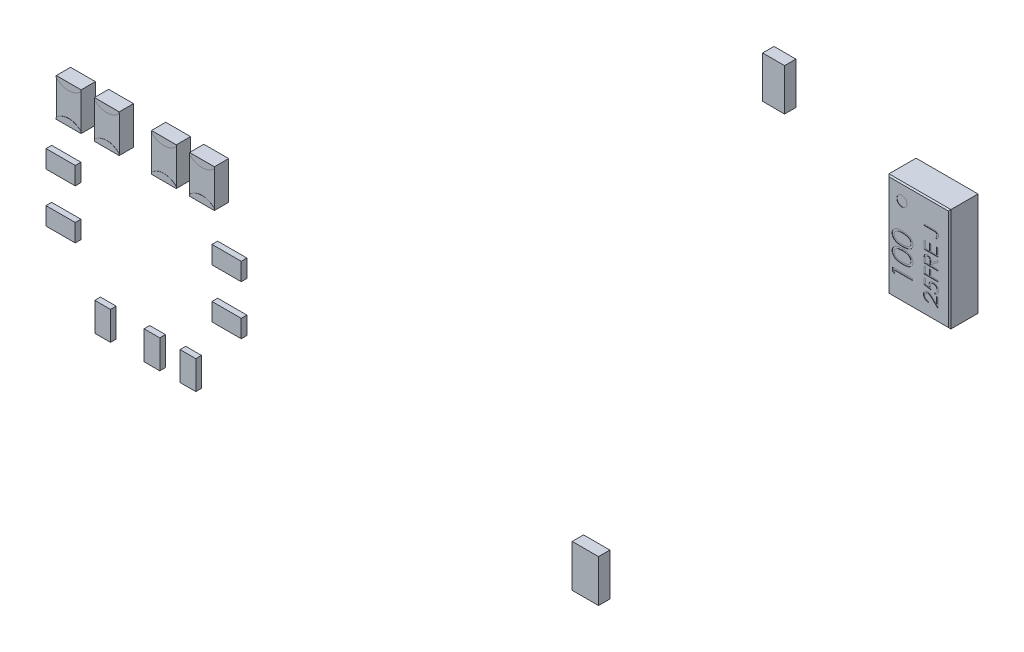
from build123d import *

# Parameters (mm, degrees)
SZKIC1_W                      = 4.373721056
SZKIC1_H                      = 7.300749762
DODANIE_WYCI_GNI_CIE1_DEPTH   = 2
SFAZOWANIE1_SIZE              = 0.09
SZKIC2_R                      = 0.357953931
WYTNIJ_WYCI_GNI_CIE1_DEPTH    = 0.02
SZKIC3_W                      = 2.452582434
SZKIC3_H                      = 1.034404964
DODANIE_WYCI_GNI_CIE2_DEPTH   = 0.1
SZKIC4_W                      = 1.85738294
SZKIC4_H                      = 2.99399041
DODANIE_WYCI_GNI_CIE3_DEPTH   = 0.8
SZKIC4_W_2                    = 1.547624374
SZKIC4_H_2                    = 2.960672714
DODANIE_WYCI_GNI_CIE3_2_DEPTH = 0.8
SZKIC5_W                      = 1.752306705
SZKIC5_H                      = 2.673622601
DODANIE_WYCI_GNI_CIE4_DEPTH   = 1
DODANIE_WYCI_GNI_CIE4_2_DEPTH = 1
DODANIE_WYCI_GNI_CIE4_3_DEPTH = 1
DODANIE_WYCI_GNI_CIE4_4_DEPTH = 1
DODANIE_WYCI_GNI_CIE5_DEPTH   = 0.01
DODANIE_WYCI_GNI_CIE5_2_DEPTH = 0.01
DODANIE_WYCI_GNI_CIE5_3_DEPTH = 0.01
DODANIE_WYCI_GNI_CIE5_4_DEPTH = 0.01
DODANIE_WYCI_GNI_CIE5_5_DEPTH = 0.01
DODANIE_WYCI_GNI_CIE5_6_DEPTH = 0.01
DODANIE_WYCI_GNI_CIE5_7_DEPTH = 0.01
DODANIE_WYCI_GNI_CIE5_8_DEPTH = 0.01
SZKIC7_W                      = 2.063385055
SZKIC7_H                      = 1.252139649
DODANIE_WYCI_GNI_CIE6_DEPTH   = 0.4
SZKIC7_W_2                    = 1.109303583
SZKIC7_H_2                    = 2.016915605
DODANIE_WYCI_GNI_CIE6_2_DEPTH = 0.4
SZKIC7_W_3                    = 2.063385056
DODANIE_WYCI_GNI_CIE6_3_DEPTH = 0.4
DODANIE_WYCI_GNI_CIE6_4_DEPTH = 0.4
DODANIE_WYCI_GNI_CIE6_5_DEPTH = 0.4
DODANIE_WYCI_GNI_CIE6_6_DEPTH = 0.4
DODANIE_WYCI_GNI_CIE6_7_DEPTH = 0.4


with BuildPart() as part:
    # Szkic1 → Dodanie-wyciągnięcie1 (new body)
    with BuildSketch(Plane.XY):
        with Locations((30.503224467, 15.085500347)):
            Rectangle(SZKIC1_W, SZKIC1_H)
    extrude(amount=DODANIE_WYCI_GNI_CIE1_DEPTH)

    # Sfazowanie1
    sfazowanie1_edges = [part.edges().sort_by_distance(p)[0] for p in [
        (30.503224467, 18.735875228, 2),
        (28.316363939, 15.085500347, 2),
        (30.503224467, 11.435125466, 2),
        (32.690084995, 15.085500347, 2),
    ]]
    chamfer(sfazowanie1_edges, length=SFAZOWANIE1_SIZE)

    # Szkic2 → Wytnij-wyciągnięcie1 (cut)
    # profile 1 of 10: a face of its own
    with BuildSketch(Plane.XY.offset(2)):
        with Locations((29.31812513, 17.607576916)):
            Circle(SZKIC2_R)
    # profile 2 of 10: a face of its own
    with BuildSketch(Plane.XY.offset(2)):
        Polygon((28.664949594, 12.997179442), (28.664949594, 13.256033609), (30.064949594, 13.256033609), (30.064949594, 13.130392583), (28.808539337, 13.130392583), (28.808539337, 12.915007968), align=None)
    # profile 3 of 10: a face of its own
    with BuildSketch(Plane.XY.offset(2)):
        with BuildLine():
            add(Edge.make_bspline(
                [(29.365510491, 13.776546429), (29.343071536, 13.776677637), (29.299483542, 13.776932509), (29.235969686, 13.779767877), (29.17638557, 13.784478014), (29.120728344, 13.790932963), (29.068983637, 13.798788154), (29.021289737, 13.809274352), (28.977425884, 13.821199463), (28.937249101, 13.835020476), (28.900217893, 13.850615473), (28.865648259, 13.867589593), (28.833589905, 13.886614038), (28.803540441, 13.906610068), (28.775958808, 13.928356125), (28.750527213, 13.951385933), (28.727460125, 13.97616009), (28.706741747, 14.002438311), (28.688574754, 14.030042496), (28.672474095, 14.058218325), (28.659212068, 14.087469238), (28.648363364, 14.117410163), (28.639507318, 14.148104204), (28.633424121, 14.179543526), (28.629603389, 14.211801006), (28.629237645, 14.233573452), (28.629052158, 14.24461534)],
                knots=[0, 0, 0, 0, 1.646148282, 3.197666765, 4.66315463, 6.030252048, 7.307778049, 8.501004361, 9.610818041, 10.641065266, 11.615491391, 12.557119604, 13.464013759, 14.348536654, 15.203310953, 16.038349431, 16.863300206, 17.683791446, 18.490318933, 19.285717724, 20.06220424, 20.843281102, 21.620494212, 22.403315558, 23.190242141, 24, 24, 24, 24], degree=3))
            add(Edge.make_bspline(
                [(28.629052158, 14.24461534), (28.629206658, 14.255754931), (28.629514058, 14.277918796), (28.633840906, 14.310568856), (28.639425693, 14.342650207), (28.648382772, 14.373676112), (28.659101079, 14.404233211), (28.673243715, 14.433561612), (28.688624929, 14.46269676), (28.707388717, 14.490315086), (28.72812579, 14.517241775), (28.75166767, 14.542482734), (28.777362832, 14.566683191), (28.805784354, 14.588929102), (28.836496448, 14.610173898), (28.869756572, 14.629611104), (28.905491017, 14.647644978), (28.943534121, 14.66461451), (28.984902077, 14.679453918), (29.02933686, 14.692647337), (29.07724085, 14.703461577), (29.12834719, 14.712404763), (29.182909062, 14.719346378), (29.240815915, 14.724398368), (29.302103978, 14.727067905), (29.344007131, 14.727570543), (29.365510491, 14.727828481)],
                knots=[0, 0, 0, 0, 0.810910589, 1.61342667, 2.396193133, 3.181089899, 3.963115317, 4.752255436, 5.550715454, 6.36105385, 7.181178335, 8.024612154, 8.872680183, 9.750181803, 10.651284446, 11.591556747, 12.554036451, 13.566402641, 14.62422919, 15.753422176, 16.94128843, 18.199818041, 19.531985927, 20.947085226, 22.433341622, 24, 24, 24, 24], degree=3))
            add(Edge.make_bspline(
                [(29.365510491, 14.727828481), (29.386919867, 14.727564868), (29.42872854, 14.727050081), (29.489743711, 14.724455622), (29.547338434, 14.719222981), (29.601574114, 14.712773093), (29.652475896, 14.70372995), (29.700010612, 14.69283371), (29.744346558, 14.680419065), (29.785166072, 14.665351912), (29.82314316, 14.64877736), (29.858614851, 14.630762837), (29.891866192, 14.611435319), (29.922659295, 14.590509146), (29.950966737, 14.567897312), (29.976750029, 14.543713818), (30.000441645, 14.518252475), (30.021407179, 14.491168809), (30.040313825, 14.463293235), (30.056253215, 14.434155126), (30.070063761, 14.404500205), (30.081355157, 14.374032397), (30.090111766, 14.34279874), (30.096131458, 14.3106954), (30.100362839, 14.277914189), (30.100685074, 14.25575339), (30.10084703, 14.24461534)],
                knots=[0, 0, 0, 0, 1.561645053, 3.049612875, 4.452756685, 5.778837748, 7.032101753, 8.221335837, 9.334924186, 10.387562255, 11.392109817, 12.355697819, 13.287721948, 14.19548756, 15.068665045, 15.927346723, 16.771751757, 17.602390507, 18.423119567, 19.225778204, 20.022010933, 20.807278863, 21.593079439, 22.384715467, 23.188155646, 24, 24, 24, 24], degree=3))
            add(Edge.make_bspline(
                [(30.10084703, 14.24461534), (30.100660487, 14.233573694), (30.100292663, 14.211801724), (30.09648717, 14.179540754), (30.090368969, 14.148227777), (30.081802328, 14.117708274), (30.07131639, 14.087825673), (30.057654929, 14.05898714), (30.041921255, 14.030872135), (30.024003262, 14.003555253), (30.003473919, 13.97755138), (29.980770755, 13.95270816), (29.955311583, 13.929672673), (29.927497232, 13.908115174), (29.89740306, 13.887907751), (29.865008872, 13.869047702), (29.830259353, 13.851717622), (29.792935484, 13.835856186), (29.752473545, 13.821793254), (29.708497878, 13.809419246), (29.660561823, 13.799536507), (29.608908759, 13.791159357), (29.553433732, 13.784446637), (29.494116672, 13.779769833), (29.431070217, 13.776934661), (29.387762517, 13.776678202), (29.365510491, 13.776546429)],
                knots=[0, 0, 0, 0, 0.810927267, 1.598990287, 2.382942141, 3.152806972, 3.926217614, 4.706701772, 5.493896336, 6.292070767, 7.104102563, 7.925577746, 8.761822141, 9.623241997, 10.509042271, 11.423174113, 12.375371989, 13.360203808, 14.400680605, 15.520553799, 16.714061498, 17.994519714, 19.364400916, 20.818312473, 22.365209998, 24, 24, 24, 24], degree=3))
        make_face()
        with BuildLine():
            add(Edge.make_bspline(
                [(29.364949594, 13.902187455), (29.383648998, 13.902236282), (29.419940871, 13.902331044), (29.472586001, 13.904735007), (29.521770614, 13.908081079), (29.567475515, 13.912290629), (29.609540965, 13.918595029), (29.648141847, 13.925747757), (29.683206711, 13.934327017), (29.715041982, 13.944527874), (29.744098461, 13.956147643), (29.771150605, 13.968812114), (29.796519034, 13.982537915), (29.820142198, 13.997606397), (29.841731332, 14.014315472), (29.861833671, 14.031890508), (29.879750072, 14.051123248), (29.901241577, 14.077723562), (29.92344887, 14.11284271), (29.942787415, 14.157090724), (29.95494037, 14.202558146), (29.956485876, 14.233418641), (29.957257286, 14.24882207)],
                knots=[0, 0, 0, 0, 1.459098681, 2.831824031, 4.11146945, 5.306290378, 6.412266529, 7.42953815, 8.369053297, 9.227277979, 10.03601793, 10.809473603, 11.557037441, 12.285528272, 12.993193355, 13.685654407, 14.36688038, 15.041354379, 16.352855396, 17.594313975, 18.799247529, 20, 20, 20, 20], degree=3))
            add(Edge.make_bspline(
                [(29.957257286, 14.24882207), (29.956581824, 14.264314664), (29.955233297, 14.295244897), (29.943463884, 14.340670553), (29.924330555, 14.384405148), (29.902471181, 14.418920026), (29.881520504, 14.445105466), (29.863678632, 14.463873824), (29.843695176, 14.481098209), (29.822135766, 14.497435159), (29.798586687, 14.512418756), (29.773161681, 14.526044021), (29.745790003, 14.538477357), (29.726682108, 14.545560976), (29.716912735, 14.549182647)],
                knots=[0, 0, 0, 0, 1.353621445, 2.702441307, 4.075953605, 5.516772412, 6.261413105, 7.007624062, 7.778524365, 8.566925914, 9.372323995, 10.217594641, 11.088702136, 12, 12, 12, 12], degree=3))
            add(Edge.make_bspline(
                [(29.716912735, 14.549182647), (29.704420839, 14.553403354), (29.679056933, 14.5619732), (29.639711472, 14.57301791), (29.598430367, 14.581716069), (29.55546032, 14.589541416), (29.51048444, 14.594882638), (29.463641886, 14.599181763), (29.414897341, 14.601714038), (29.381779345, 14.602027939), (29.364949594, 14.602187455)],
                knots=[0, 0, 0, 0, 0.884706709, 1.796334032, 2.740027952, 3.714592787, 4.726048262, 5.777819803, 6.87074269, 8, 8, 8, 8], degree=3))
            add(Edge.make_bspline(
                [(29.364949594, 14.602187455), (29.348122565, 14.601967379), (29.315205299, 14.601536864), (29.266998027, 14.599891269), (29.221210922, 14.595641839), (29.177646733, 14.590922192), (29.136546611, 14.583963304), (29.097566492, 14.576460178), (29.061189271, 14.566379704), (29.026845478, 14.555611756), (28.99492508, 14.54328773), (28.965280036, 14.529720979), (28.937764498, 14.515233877), (28.912463481, 14.499491383), (28.889230228, 14.482712776), (28.868599334, 14.464296467), (28.84956722, 14.44541203), (28.828230815, 14.418554379), (28.806304137, 14.383678902), (28.786674781, 14.339982679), (28.775057599, 14.294758972), (28.773446553, 14.26412333), (28.772641901, 14.24882207)],
                knots=[0, 0, 0, 0, 1.313483664, 2.569454835, 3.763100662, 4.901599063, 5.988328865, 7.015709358, 7.99797933, 8.932480776, 9.824041341, 10.666387587, 11.475829342, 12.24921787, 12.990555181, 13.709176526, 14.405678811, 15.080244297, 16.38186033, 17.610124501, 18.806354173, 20, 20, 20, 20], degree=3))
            add(Edge.make_bspline(
                [(28.772641901, 14.24882207), (28.773448555, 14.233335481), (28.775063333, 14.202334091), (28.786621056, 14.156627436), (28.806246705, 14.112636019), (28.828188571, 14.077645536), (28.849485414, 14.05111416), (28.86761148, 14.032286874), (28.887233683, 14.014468097), (28.909014337, 13.998191701), (28.932554265, 13.983212572), (28.957594636, 13.968956317), (28.984697327, 13.956461203), (29.013731021, 13.94480413), (29.045568044, 13.934586258), (29.080759784, 13.926105025), (29.119452848, 13.918383866), (29.161825653, 13.912823373), (29.207540308, 13.907926989), (29.256850702, 13.904771741), (29.309676611, 13.902320032), (29.346156252, 13.902232532), (29.364949594, 13.902187455)],
                knots=[0, 0, 0, 0, 1.207546505, 2.417292871, 3.651582144, 4.952510111, 5.626719005, 6.30238548, 6.989136872, 7.692112372, 8.420316868, 9.164734959, 9.937886623, 10.746308695, 11.604196049, 12.543341915, 13.568754172, 14.680483261, 15.875568977, 17.154711427, 18.534182925, 20, 20, 20, 20], degree=3))
        make_face(mode=Mode.SUBTRACT)
    # profile 4 of 10: a face of its own
    with BuildSketch(Plane.XY.offset(2)):
        with BuildLine():
            add(Edge.make_bspline(
                [(29.365510491, 14.853469506), (29.343071536, 14.853600714), (29.299483542, 14.853855586), (29.235969686, 14.856690954), (29.17638557, 14.861401091), (29.120728344, 14.86785604), (29.068983637, 14.875711231), (29.021289737, 14.886197429), (28.977425884, 14.89812254), (28.937249101, 14.911943552), (28.900217893, 14.92753855), (28.865648259, 14.94451267), (28.833589905, 14.963537115), (28.803540441, 14.983533145), (28.775958808, 15.005279202), (28.750527213, 15.02830901), (28.727460125, 15.053083167), (28.706741747, 15.079361388), (28.688574754, 15.106965573), (28.672474095, 15.135141402), (28.659212068, 15.164392315), (28.648363364, 15.19433324), (28.639507318, 15.225027281), (28.633424121, 15.256466603), (28.629603389, 15.288724083), (28.629237645, 15.310496529), (28.629052158, 15.321538417)],
                knots=[0, 0, 0, 0, 1.646148282, 3.197666765, 4.66315463, 6.030252048, 7.307778049, 8.501004361, 9.610818041, 10.641065266, 11.615491391, 12.557119604, 13.464013759, 14.348536654, 15.203310953, 16.038349431, 16.863300206, 17.683791446, 18.490318933, 19.285717724, 20.06220424, 20.843281102, 21.620494212, 22.403315558, 23.190242141, 24, 24, 24, 24], degree=3))
            add(Edge.make_bspline(
                [(28.629052158, 15.321538417), (28.629206658, 15.332678008), (28.629514058, 15.354841873), (28.633840906, 15.387491933), (28.639425693, 15.419573284), (28.648382772, 15.450599189), (28.659101079, 15.481156288), (28.673243715, 15.510484689), (28.688624929, 15.539619837), (28.707388717, 15.567238163), (28.72812579, 15.594164852), (28.75166767, 15.619405811), (28.777362832, 15.643606268), (28.805784354, 15.665852179), (28.836496448, 15.687096975), (28.869756572, 15.706534181), (28.905491017, 15.724568055), (28.943534121, 15.741537587), (28.984902077, 15.756376995), (29.02933686, 15.769570414), (29.07724085, 15.780384654), (29.12834719, 15.78932784), (29.182909062, 15.796269455), (29.240815915, 15.801321445), (29.302103978, 15.803990982), (29.344007131, 15.80449362), (29.365510491, 15.804751558)],
                knots=[0, 0, 0, 0, 0.810910589, 1.61342667, 2.396193133, 3.181089899, 3.963115317, 4.752255436, 5.550715454, 6.36105385, 7.181178335, 8.024612154, 8.872680183, 9.750181803, 10.651284446, 11.591556747, 12.554036451, 13.566402641, 14.62422919, 15.753422176, 16.94128843, 18.199818041, 19.531985927, 20.947085226, 22.433341622, 24, 24, 24, 24], degree=3))
            add(Edge.make_bspline(
                [(29.365510491, 15.804751558), (29.386919867, 15.804487945), (29.42872854, 15.803973157), (29.489743711, 15.801378699), (29.547338434, 15.796146058), (29.601574114, 15.78969617), (29.652475896, 15.780653026), (29.700010612, 15.769756787), (29.744346558, 15.757342142), (29.785166072, 15.742274989), (29.82314316, 15.725700437), (29.858614851, 15.707685914), (29.891866192, 15.688358396), (29.922659295, 15.667432223), (29.950966737, 15.644820389), (29.976750029, 15.620636895), (30.000441645, 15.595175552), (30.021407179, 15.568091886), (30.040313825, 15.540216312), (30.056253215, 15.511078203), (30.070063761, 15.481423282), (30.081355157, 15.450955474), (30.090111766, 15.419721817), (30.096131458, 15.387618477), (30.100362839, 15.354837266), (30.100685074, 15.332676466), (30.10084703, 15.321538417)],
                knots=[0, 0, 0, 0, 1.561645053, 3.049612875, 4.452756685, 5.778837748, 7.032101753, 8.221335837, 9.334924186, 10.387562255, 11.392109817, 12.355697819, 13.287721948, 14.19548756, 15.068665045, 15.927346723, 16.771751757, 17.602390507, 18.423119567, 19.225778204, 20.022010933, 20.807278863, 21.593079439, 22.384715467, 23.188155646, 24, 24, 24, 24], degree=3))
            add(Edge.make_bspline(
                [(30.10084703, 15.321538417), (30.100660487, 15.310496771), (30.100292663, 15.288724801), (30.09648717, 15.256463831), (30.090368969, 15.225150854), (30.081802328, 15.194631351), (30.07131639, 15.16474875), (30.057654929, 15.135910217), (30.041921255, 15.107795212), (30.024003262, 15.08047833), (30.003473919, 15.054474457), (29.980770755, 15.029631237), (29.955311583, 15.00659575), (29.927497232, 14.985038251), (29.89740306, 14.964830827), (29.865008872, 14.945970779), (29.830259353, 14.928640699), (29.792935484, 14.912779263), (29.752473545, 14.898716331), (29.708497878, 14.886342323), (29.660561823, 14.876459584), (29.608908759, 14.868082434), (29.553433732, 14.861369714), (29.494116672, 14.85669291), (29.431070217, 14.853857738), (29.387762517, 14.853601278), (29.365510491, 14.853469506)],
                knots=[0, 0, 0, 0, 0.810927267, 1.598990287, 2.382942141, 3.152806972, 3.926217614, 4.706701772, 5.493896336, 6.292070767, 7.104102563, 7.925577746, 8.761822141, 9.623241997, 10.509042271, 11.423174113, 12.375371989, 13.360203808, 14.400680605, 15.520553799, 16.714061498, 17.994519714, 19.364400916, 20.818312473, 22.365209998, 24, 24, 24, 24], degree=3))
        make_face()
        with BuildLine():
            add(Edge.make_bspline(
                [(29.364949594, 14.979110532), (29.383648998, 14.979159358), (29.419940871, 14.979254121), (29.472586001, 14.981658084), (29.521770614, 14.985004155), (29.567475515, 14.989213706), (29.609540965, 14.995518106), (29.648141847, 15.002670833), (29.683206711, 15.011250094), (29.715041982, 15.021450951), (29.744098461, 15.03307072), (29.771150605, 15.045735191), (29.796519034, 15.059460992), (29.820142198, 15.074529473), (29.841731332, 15.091238549), (29.861833671, 15.108813584), (29.879750072, 15.128046325), (29.901241577, 15.154646639), (29.92344887, 15.189765787), (29.942787415, 15.234013801), (29.95494037, 15.279481223), (29.956485876, 15.310341718), (29.957257286, 15.325745147)],
                knots=[0, 0, 0, 0, 1.459098681, 2.831824031, 4.11146945, 5.306290378, 6.412266529, 7.42953815, 8.369053297, 9.227277979, 10.03601793, 10.809473603, 11.557037441, 12.285528272, 12.993193355, 13.685654407, 14.36688038, 15.041354379, 16.352855396, 17.594313975, 18.799247529, 20, 20, 20, 20], degree=3))
            add(Edge.make_bspline(
                [(29.957257286, 15.325745147), (29.956581824, 15.341237741), (29.955233297, 15.372167974), (29.943463884, 15.41759363), (29.924330555, 15.461328225), (29.902471181, 15.495843103), (29.881520504, 15.522028543), (29.863678632, 15.540796901), (29.843695176, 15.558021286), (29.822135766, 15.574358236), (29.798586687, 15.589341833), (29.773161681, 15.602967098), (29.745790003, 15.615400434), (29.726682108, 15.622484053), (29.716912735, 15.626105724)],
                knots=[0, 0, 0, 0, 1.353621445, 2.702441307, 4.075953605, 5.516772412, 6.261413105, 7.007624062, 7.778524365, 8.566925914, 9.372323995, 10.217594641, 11.088702136, 12, 12, 12, 12], degree=3))
            add(Edge.make_bspline(
                [(29.716912735, 15.626105724), (29.704420839, 15.630326431), (29.679056933, 15.638896277), (29.639711472, 15.649940987), (29.598430367, 15.658639146), (29.55546032, 15.666464493), (29.51048444, 15.671805715), (29.463641886, 15.67610484), (29.414897341, 15.678637115), (29.381779345, 15.678951015), (29.364949594, 15.679110532)],
                knots=[0, 0, 0, 0, 0.884706709, 1.796334032, 2.740027952, 3.714592787, 4.726048262, 5.777819803, 6.87074269, 8, 8, 8, 8], degree=3))
            add(Edge.make_bspline(
                [(29.364949594, 15.679110532), (29.348122565, 15.678890456), (29.315205299, 15.678459941), (29.266998027, 15.676814346), (29.221210922, 15.672564916), (29.177646733, 15.667845269), (29.136546611, 15.660886381), (29.097566492, 15.653383255), (29.061189271, 15.643302781), (29.026845478, 15.632534833), (28.99492508, 15.620210807), (28.965280036, 15.606644056), (28.937764498, 15.592156954), (28.912463481, 15.57641446), (28.889230228, 15.559635852), (28.868599334, 15.541219544), (28.84956722, 15.522335106), (28.828230815, 15.495477456), (28.806304137, 15.460601979), (28.786674781, 15.416905756), (28.775057599, 15.371682049), (28.773446553, 15.341046407), (28.772641901, 15.325745147)],
                knots=[0, 0, 0, 0, 1.313483664, 2.569454835, 3.763100662, 4.901599063, 5.988328865, 7.015709358, 7.99797933, 8.932480776, 9.824041341, 10.666387587, 11.475829342, 12.24921787, 12.990555181, 13.709176526, 14.405678811, 15.080244297, 16.38186033, 17.610124501, 18.806354173, 20, 20, 20, 20], degree=3))
            add(Edge.make_bspline(
                [(28.772641901, 15.325745147), (28.773448555, 15.310258558), (28.775063333, 15.279257168), (28.786621056, 15.233550513), (28.806246705, 15.189559096), (28.828188571, 15.154568613), (28.849485414, 15.128037237), (28.86761148, 15.109209951), (28.887233683, 15.091391174), (28.909014337, 15.075114778), (28.932554265, 15.060135648), (28.957594636, 15.045879394), (28.984697327, 15.03338428), (29.013731021, 15.021727207), (29.045568044, 15.011509335), (29.080759784, 15.003028102), (29.119452848, 14.995306943), (29.161825653, 14.98974645), (29.207540308, 14.984850066), (29.256850702, 14.981694818), (29.309676611, 14.979243108), (29.346156252, 14.979155609), (29.364949594, 14.979110532)],
                knots=[0, 0, 0, 0, 1.207546505, 2.417292871, 3.651582144, 4.952510111, 5.626719005, 6.30238548, 6.989136872, 7.692112372, 8.420316868, 9.164734959, 9.937886623, 10.746308695, 11.604196049, 12.543341915, 13.568754172, 14.680483261, 15.875568977, 17.154711427, 18.534182925, 20, 20, 20, 20], degree=3))
        make_face(mode=Mode.SUBTRACT)
    # profile 5 of 10: a face of its own
    with BuildSketch(Plane.XY.offset(2)):
        with BuildLine():
            Line((31.179149727, 12.445550109), (31.179149727, 12.355806519))
            add(Edge.make_bspline(
                [(31.179149727, 12.355806519), (31.167243759, 12.35639142), (31.143860754, 12.35754015), (31.10976821, 12.362919661), (31.077181124, 12.370617055), (31.046361149, 12.381500327), (31.017035775, 12.395016407), (30.989321485, 12.411224986), (30.963324003, 12.430423229), (30.939284333, 12.452196581), (30.917230742, 12.475844764), (30.898186387, 12.501360747), (30.882095623, 12.528173612), (30.86864384, 12.556202011), (30.858546741, 12.585762172), (30.851054844, 12.616585846), (30.846547317, 12.648808456), (30.846062807, 12.670762748), (30.845816393, 12.681928314)],
                knots=[0, 0, 0, 0, 1.10065271, 2.161652631, 3.183658789, 4.190468796, 5.17591951, 6.163126047, 7.15150782, 8.156236427, 9.156009102, 10.134482811, 11.092018607, 12.041330605, 13.001268258, 13.972401359, 14.968799086, 16, 16, 16, 16], degree=3))
            add(Edge.make_bspline(
                [(30.845816393, 12.681928314), (30.846071012, 12.69289425), (30.846571329, 12.714441922), (30.850932521, 12.745877295), (30.857615659, 12.775874181), (30.867519017, 12.804092624), (30.879945565, 12.830822225), (30.895399605, 12.855732027), (30.913149905, 12.879424376), (30.934087254, 12.900736491), (30.956427458, 12.920314241), (30.980286608, 12.937189077), (31.004957704, 12.951721819), (31.030633463, 12.963616414), (31.057397498, 12.972633046), (31.084993212, 12.979313506), (31.113739079, 12.983132418), (31.133198655, 12.983715304), (31.143092034, 12.984011648)],
                knots=[0, 0, 0, 0, 1.111674182, 2.184400057, 3.212814286, 4.223731311, 5.211378316, 6.196328225, 7.191884489, 8.207283132, 9.220262353, 10.201199469, 11.166417575, 12.120932471, 13.06540007, 14.026332106, 14.996573967, 16, 16, 16, 16], degree=3))
            add(Edge.make_bspline(
                [(31.143092034, 12.984011648), (31.157019981, 12.983527851), (31.184631459, 12.982568747), (31.225207222, 12.97436475), (31.264519293, 12.961551037), (31.2961596, 12.946124588), (31.32165247, 12.930557973), (31.342652403, 12.916544222), (31.365257735, 12.900045511), (31.389559961, 12.881202795), (31.415240822, 12.859691578), (31.442824277, 12.836070717), (31.471800288, 12.809730196), (31.491604188, 12.791259159), (31.501866073, 12.78168793)],
                knots=[0, 0, 0, 0, 1.184416499, 2.348048165, 3.509039915, 4.696071444, 5.333504901, 6.05069495, 6.844171097, 7.714965912, 8.667477798, 9.695072654, 10.805644396, 12, 12, 12, 12], degree=3))
            Line((31.501866073, 12.78168793), (31.768893316, 12.531487609))
            Line((31.768893316, 12.531487609), (31.768893316, 12.99683216))
            Line((31.768893316, 12.99683216), (31.871457419, 12.99683216))
            Line((31.871457419, 12.99683216), (31.871457419, 12.317344981))
            Line((31.871457419, 12.317344981), (31.457595239, 12.705165494))
            add(Edge.make_bspline(
                [(31.457595239, 12.705165494), (31.44773858, 12.714607747), (31.428805956, 12.732744383), (31.40116511, 12.758396548), (31.375522384, 12.781436259), (31.351926227, 12.802012657), (31.330031494, 12.819679373), (31.310547293, 12.835357153), (31.29261745, 12.847918751), (31.271834417, 12.861551721), (31.246459469, 12.874755716), (31.215449844, 12.886102103), (31.183527772, 12.893020631), (31.161955761, 12.893850584), (31.151104855, 12.894268058)],
                knots=[0, 0, 0, 0, 1.329631726, 2.553950428, 3.673215718, 4.687767853, 5.603093632, 6.413772471, 7.123043292, 7.734684054, 8.834405432, 9.900288307, 10.943827018, 12, 12, 12, 12], degree=3))
            add(Edge.make_bspline(
                [(31.151104855, 12.894268058), (31.144281598, 12.894086417), (31.130834269, 12.893728438), (31.111118338, 12.890569096), (31.09209982, 12.885794666), (31.073720215, 12.878953164), (31.056164314, 12.869922666), (31.039410748, 12.858930272), (31.023213901, 12.846247397), (31.008027244, 12.831575606), (30.994118329, 12.815458029), (30.981797161, 12.7984311), (30.971500272, 12.780416785), (30.963059273, 12.761491035), (30.956437736, 12.741706616), (30.95184957, 12.72102526), (30.948968861, 12.699504112), (30.948579097, 12.684808828), (30.948380496, 12.677320942)],
                knots=[0, 0, 0, 0, 0.991446411, 1.95395049, 2.89581595, 3.838931463, 4.798493298, 5.75982156, 6.748411868, 7.785213223, 8.824556874, 9.840280684, 10.836137867, 11.835679398, 12.848801643, 13.863922112, 14.911575587, 16, 16, 16, 16], degree=3))
            add(Edge.make_bspline(
                [(30.948380496, 12.677320942), (30.94857673, 12.669498742), (30.9489621, 12.654137231), (30.95188109, 12.631631005), (30.956306281, 12.610012794), (30.963334449, 12.589605159), (30.971638579, 12.569966188), (30.982188082, 12.551515141), (30.994446838, 12.533945674), (31.008661365, 12.51754677), (31.024632415, 12.502569352), (31.042233614, 12.489224689), (31.061338248, 12.477641523), (31.081867907, 12.467521203), (31.104026992, 12.459306245), (31.127731806, 12.453027932), (31.152880841, 12.448060337), (31.170247998, 12.446400749), (31.179149727, 12.445550109)],
                knots=[0, 0, 0, 0, 1.030878251, 2.024474673, 2.987898669, 3.934362936, 4.864849709, 5.795128259, 6.730474222, 7.685293701, 8.650606017, 9.611896181, 10.591709709, 11.591680886, 12.625074257, 13.701333388, 14.821793024, 16, 16, 16, 16], degree=3))
        make_face()
    # profile 6 of 10: a face of its own
    with BuildSketch(Plane.XY.offset(2)):
        with BuildLine():
            Line((30.871457419, 13.714780878), (30.974021521, 13.714780878))
            Line((30.974021521, 13.714780878), (30.974021521, 13.374636648))
            Line((30.974021521, 13.374636648), (31.237042355, 13.32075043))
            add(Edge.make_bspline(
                [(31.237042355, 13.32075043), (31.23411942, 13.331337822), (31.228456696, 13.351849221), (31.222169333, 13.382123467), (31.218379206, 13.410864097), (31.217861689, 13.429514202), (31.217611265, 13.438538891)],
                knots=[0, 0, 0, 0, 1.100273476, 2.13160584, 3.095893838, 4, 4, 4, 4], degree=3))
            add(Edge.make_bspline(
                [(31.217611265, 13.438538891), (31.217844979, 13.449707724), (31.218304519, 13.471668439), (31.222979137, 13.503749669), (31.229749941, 13.534528908), (31.240181645, 13.563551703), (31.252920617, 13.591277224), (31.268965631, 13.617229318), (31.287698145, 13.641772225), (31.309021682, 13.664736316), (31.332733288, 13.685471459), (31.358333438, 13.703489614), (31.385263493, 13.719216121), (31.41415464, 13.731481385), (31.444461982, 13.741491038), (31.476535367, 13.748091427), (31.510090055, 13.752500201), (31.533034485, 13.752991756), (31.544734662, 13.753242417)],
                knots=[0, 0, 0, 0, 1.052805225, 2.070078116, 3.052532748, 4.020689046, 4.973125432, 5.925915817, 6.89216474, 7.881560752, 8.877013184, 9.857446635, 10.830895175, 11.812622661, 12.812548702, 13.836681939, 14.896847428, 16, 16, 16, 16], degree=3))
            add(Edge.make_bspline(
                [(31.544734662, 13.753242417), (31.552883817, 13.753052224), (31.569071998, 13.752674409), (31.593113945, 13.750757322), (31.616643406, 13.747052067), (31.639617244, 13.742137748), (31.662056975, 13.735577375), (31.684088239, 13.727903825), (31.705469794, 13.718366112), (31.726296076, 13.70779249), (31.746328733, 13.696084198), (31.765087446, 13.682918483), (31.783000294, 13.669238547), (31.799535292, 13.654290691), (31.814756577, 13.638244864), (31.828739398, 13.621190347), (31.841734706, 13.603281827), (31.853211159, 13.584237247), (31.863772051, 13.564482313), (31.872435906, 13.543731377), (31.880181775, 13.522456896), (31.886355924, 13.500352645), (31.891193797, 13.477468698), (31.894479683, 13.453767334), (31.896872951, 13.429372857), (31.897022767, 13.412837139), (31.897098444, 13.404484404)],
                knots=[0, 0, 0, 0, 1.056393913, 2.098511576, 3.122979385, 4.141471433, 5.141222888, 6.151259816, 7.162667642, 8.172852865, 9.177685681, 10.166741883, 11.141342384, 12.097242845, 13.052202613, 14.005160326, 14.953864445, 15.917140761, 16.884916217, 17.854238259, 18.828761908, 19.81781811, 20.826036654, 21.857789401, 22.917898972, 24, 24, 24, 24], degree=3))
            add(Edge.make_bspline(
                [(31.897098444, 13.404484404), (31.896900531, 13.394520606), (31.896511161, 13.374918012), (31.892456303, 13.346194228), (31.886610409, 13.31857471), (31.877949399, 13.29217783), (31.866608424, 13.267113679), (31.853133629, 13.243023344), (31.837092093, 13.220205413), (31.818630541, 13.198815887), (31.798345185, 13.179154171), (31.776542401, 13.161324782), (31.753194423, 13.145649457), (31.72837717, 13.132071335), (31.702134662, 13.120504012), (31.674386041, 13.111413039), (31.645271533, 13.104076634), (31.625227703, 13.100972763), (31.615047162, 13.099396263)],
                knots=[0, 0, 0, 0, 1.046872515, 2.059598001, 3.044168548, 4.012104806, 4.973680974, 5.932408326, 6.910122221, 7.900780896, 8.89867654, 9.876692837, 10.858029398, 11.85084981, 12.847361615, 13.868568023, 14.917415949, 16, 16, 16, 16], degree=3))
            Line((31.615047162, 13.099396263), (31.615047162, 13.189139853))
            add(Edge.make_bspline(
                [(31.615047162, 13.189139853), (31.624584285, 13.191346631), (31.642915163, 13.19558818), (31.668653762, 13.204922492), (31.691598099, 13.216224482), (31.711888459, 13.229977036), (31.729896253, 13.245918006), (31.745773685, 13.26444856), (31.760115341, 13.28510544), (31.772090342, 13.308071834), (31.782177665, 13.332348423), (31.789376311, 13.357612165), (31.793733806, 13.383499466), (31.794266492, 13.400928786), (31.794534342, 13.409692737)],
                knots=[0, 0, 0, 0, 1.13623081, 2.183898708, 3.172478118, 4.09966615, 5.022692284, 5.957376522, 6.927682873, 7.937366477, 8.960015386, 9.976409503, 10.982481913, 12, 12, 12, 12], degree=3))
            add(Edge.make_bspline(
                [(31.794534342, 13.409692737), (31.794297872, 13.418251567), (31.79383226, 13.435103972), (31.790306401, 13.45991764), (31.784733535, 13.483804284), (31.77692627, 13.506806306), (31.766597717, 13.528810678), (31.753909683, 13.549786288), (31.739178726, 13.570031953), (31.722341779, 13.589014837), (31.703776916, 13.60639662), (31.683926779, 13.621755751), (31.662750394, 13.634549092), (31.640615246, 13.645330283), (31.617278505, 13.653516935), (31.5928496, 13.659357217), (31.567268177, 13.662786662), (31.549819803, 13.663258428), (31.540928573, 13.663498827)],
                knots=[0, 0, 0, 0, 1.027268864, 2.022700798, 3.002744649, 3.968653148, 4.933396556, 5.915045722, 6.907600446, 7.935526002, 8.956456544, 9.95700807, 10.942805781, 11.92166854, 12.907987664, 13.905483474, 14.932689774, 16, 16, 16, 16], degree=3))
            add(Edge.make_bspline(
                [(31.540928573, 13.663498827), (31.532905981, 13.663316406), (31.517269121, 13.66296085), (31.494311792, 13.65988282), (31.472554997, 13.65474102), (31.451904068, 13.647420141), (31.432425032, 13.63828345), (31.414160815, 13.626812057), (31.396939686, 13.613494425), (31.381204816, 13.597946391), (31.366659394, 13.581033348), (31.354304767, 13.562320884), (31.343798163, 13.542308551), (31.335189857, 13.520959264), (31.328332683, 13.498246725), (31.323593597, 13.474158702), (31.320757799, 13.448689703), (31.320373108, 13.431268091), (31.320175368, 13.42231293)],
                knots=[0, 0, 0, 0, 1.045723156, 2.038222538, 3.013889863, 3.95567481, 4.890389958, 5.81331128, 6.76251276, 7.723027653, 8.692928204, 9.666105983, 10.639751036, 11.635719707, 12.66315958, 13.728667616, 14.832476222, 16, 16, 16, 16], degree=3))
            add(Edge.make_bspline(
                [(31.320175368, 13.42231293), (31.320341251, 13.414561807), (31.320683757, 13.398557706), (31.323205614, 13.374008327), (31.327273984, 13.348210691), (31.332870054, 13.321263693), (31.340193219, 13.293086405), (31.348968791, 13.26373829), (31.35946079, 13.233157643), (31.36738428, 13.212552578), (31.371457419, 13.201960366)],
                knots=[0, 0, 0, 0, 0.817624296, 1.688186739, 2.600797293, 3.572016777, 4.590301741, 5.671205678, 6.80286297, 8, 8, 8, 8], degree=3))
            Line((31.371457419, 13.201960366), (30.871457419, 13.304524468))
            Line((30.871457419, 13.304524468), (30.871457419, 13.714780878))
        make_face()
    # profile 7 of 10: a face of its own
    with BuildSketch(Plane.XY.offset(2)):
        Polygon((30.871457419, 13.945550109), (30.871457419, 14.432729596), (30.974021521, 14.432729596), (30.974021521, 14.035293699), (31.281713829, 14.035293699), (31.281713829, 14.432729596), (31.384277932, 14.432729596), (31.384277932, 14.035293699), (31.871457419, 14.035293699), (31.871457419, 13.945550109), align=None)
    # profile 8 of 10: a face of its own
    with BuildSketch(Plane.XY.offset(2)):
        with BuildLine():
            Line((30.871457419, 14.612216776), (30.871457419, 14.812336968))
            add(Edge.make_bspline(
                [(30.871457419, 14.812336968), (30.871501872, 14.825691576), (30.871587227, 14.851333903), (30.872063159, 14.888069123), (30.873427261, 14.921448294), (30.874601142, 14.951453962), (30.876741696, 14.978085578), (30.878787596, 15.001424804), (30.881465784, 15.021364146), (30.883953048, 15.033434389), (30.885079214, 15.038899468)],
                knots=[0, 0, 0, 0, 1.410062039, 2.707475311, 3.878576406, 4.937260626, 5.877586885, 6.699081471, 7.410979367, 8, 8, 8, 8], degree=3))
            add(Edge.make_bspline(
                [(30.885079214, 15.038899468), (30.886886866, 15.046215641), (30.890463608, 15.060691912), (30.898023423, 15.081534871), (30.906772148, 15.101395802), (30.917046547, 15.120194004), (30.928928583, 15.137828679), (30.94219198, 15.15450649), (30.956809948, 15.1701733), (30.972914263, 15.184624645), (30.9901618, 15.197751539), (31.008505222, 15.209265848), (31.027868683, 15.218995227), (31.048282343, 15.226630292), (31.069520702, 15.233036951), (31.09180053, 15.237341437), (31.115047449, 15.24002271), (31.130864972, 15.240287594), (31.138885303, 15.240421904)],
                knots=[0, 0, 0, 0, 1.02737844, 2.032840108, 3.019645024, 3.985760442, 4.950801802, 5.916702504, 6.889791722, 7.870143693, 8.864820395, 9.842884691, 10.820524757, 11.815201459, 12.812418953, 13.84314332, 14.906358105, 16, 16, 16, 16], degree=3))
            add(Edge.make_bspline(
                [(31.138885303, 15.240421904), (31.152209619, 15.24000219), (31.17820881, 15.23918322), (31.21594049, 15.231547476), (31.251137437, 15.219039899), (31.283755334, 15.201804674), (31.313158375, 15.179856252), (31.33898422, 15.15347774), (31.360595623, 15.122654423), (31.375582139, 15.093960332), (31.385180113, 15.068613418), (31.391933358, 15.047746757), (31.397151063, 15.024984764), (31.401825386, 15.000545525), (31.405354442, 14.974327338), (31.407939183, 14.946393041), (31.409554625, 14.916722712), (31.409795198, 14.896340121), (31.409918957, 14.885854596)],
                knots=[0, 0, 0, 0, 1.260483769, 2.459530307, 3.627416485, 4.787058657, 5.939039949, 7.08810263, 8.267026773, 9.491475466, 10.141966685, 10.831826277, 11.566392101, 12.351337768, 13.187381173, 14.07005841, 15.007169909, 16, 16, 16, 16], degree=3))
            Line((31.409918957, 14.885854596), (31.871457419, 15.253242417))
            Line((31.871457419, 15.253242417), (31.871457419, 15.142264853))
            Line((31.871457419, 15.142264853), (31.409918957, 14.774877032))
            Line((31.409918957, 14.774877032), (31.409918957, 14.701960366))
            Line((31.409918957, 14.701960366), (31.871457419, 14.701960366))
            Line((31.871457419, 14.701960366), (31.871457419, 14.612216776))
            Line((31.871457419, 14.612216776), (30.871457419, 14.612216776))
        make_face()
        with BuildLine():
            Line((30.974021521, 14.701960366), (31.307354855, 14.701960366))
            Line((31.307354855, 14.701960366), (31.308757098, 14.885053314))
            add(Edge.make_bspline(
                [(31.308757098, 14.885053314), (31.308760882, 14.893601898), (31.308768217, 14.910171488), (31.307627108, 14.934143091), (31.306329119, 14.956463174), (31.304343253, 14.977046075), (31.301785486, 14.995901945), (31.298581012, 15.013018229), (31.294863654, 15.028433078), (31.289050432, 15.046353027), (31.280242652, 15.066599993), (31.266562588, 15.088122951), (31.250124985, 15.10700762), (31.230786012, 15.122387781), (31.209860653, 15.135273849), (31.187134595, 15.143945661), (31.163345048, 15.149725056), (31.146999777, 15.150356898), (31.138684983, 15.150678314)],
                knots=[0, 0, 0, 0, 1.146477201, 2.22219935, 3.21835465, 4.145220026, 4.995151787, 5.769831222, 6.480173269, 7.120302478, 8.295254187, 9.430763426, 10.528629691, 11.636497428, 12.733230534, 13.811001502, 14.886462612, 16, 16, 16, 16], degree=3))
            add(Edge.make_bspline(
                [(31.138684983, 15.150678314), (31.13064376, 15.15033386), (31.114708992, 15.149651277), (31.091369118, 15.144109019), (31.069334111, 15.134633975), (31.048575521, 15.122169513), (31.030026577, 15.106526559), (31.013983506, 15.088536693), (31.000850043, 15.068203376), (30.992121068, 15.049366515), (30.986994926, 15.032394881), (30.983269085, 15.017729442), (30.980683213, 15.00107742), (30.978233921, 14.982514543), (30.976251152, 14.962005384), (30.974883465, 14.939489834), (30.974082487, 14.915107368), (30.974042316, 14.898208321), (30.974021521, 14.889460366)],
                knots=[0, 0, 0, 0, 1.100823979, 2.181431445, 3.263702604, 4.376021382, 5.48638238, 6.575013887, 7.666064109, 8.791843368, 9.405226397, 10.093019944, 10.863016055, 11.711746407, 12.658404307, 13.684961631, 14.801597923, 16, 16, 16, 16], degree=3))
            Line((30.974021521, 14.889460366), (30.974021521, 14.701960366))
        make_face(mode=Mode.SUBTRACT)
    # profile 9 of 10: a face of its own
    with BuildSketch(Plane.XY.offset(2)):
        Polygon((30.871457419, 15.458370622), (30.871457419, 16.022473186), (30.974021521, 16.022473186), (30.974021521, 15.548114212), (31.281713829, 15.548114212), (31.281713829, 16.022473186), (31.384277932, 16.022473186), (31.384277932, 15.548114212), (31.768893316, 15.548114212), (31.768893316, 16.022473186), (31.871457419, 16.022473186), (31.871457419, 15.458370622), align=None)
    # profile 10 of 10: a face of its own
    with BuildSketch(Plane.XY.offset(2)):
        with BuildLine():
            Line((30.871457419, 16.907088571), (30.871457419, 16.99683216))
            Line((30.871457419, 16.99683216), (31.546737868, 16.99683216))
            add(Edge.make_bspline(
                [(31.546737868, 16.99683216), (31.559225023, 16.996742114), (31.583201884, 16.996569214), (31.617737765, 16.995626918), (31.649337041, 16.99385518), (31.6779476, 16.99134955), (31.70352775, 16.98789226), (31.72622911, 16.984016715), (31.745983193, 16.979296527), (31.768164045, 16.972191885), (31.792495869, 16.960545608), (31.818748433, 16.942997408), (31.841775489, 16.921300482), (31.861442179, 16.895871121), (31.877663064, 16.867173718), (31.889001675, 16.835119356), (31.895989456, 16.800286545), (31.896721363, 16.776113248), (31.897098444, 16.763659083)],
                knots=[0, 0, 0, 0, 1.237835128, 2.376794491, 3.424301355, 4.37473024, 5.222848639, 5.982427304, 6.656694867, 7.234414123, 8.288487839, 9.318384746, 10.353268049, 11.409832686, 12.494409752, 13.606195221, 14.766703628, 16, 16, 16, 16], degree=3))
            add(Edge.make_bspline(
                [(31.897098444, 16.763659083), (31.896784244, 16.753958224), (31.896152052, 16.734439452), (31.891169012, 16.705344039), (31.883032996, 16.676446331), (31.871702294, 16.64735246), (31.856092455, 16.617739806), (31.836027103, 16.586873365), (31.810875678, 16.554774566), (31.791733762, 16.533571854), (31.781713829, 16.522473186)],
                knots=[0, 0, 0, 0, 0.848740133, 1.707721362, 2.575564419, 3.47312689, 4.435109626, 5.500187059, 6.691460208, 8, 8, 8, 8], degree=3))
            Line((31.781713829, 16.522473186), (31.704790752, 16.575357801))
            add(Edge.make_bspline(
                [(31.704790752, 16.575357801), (31.713177606, 16.587574635), (31.729032904, 16.610670489), (31.749800582, 16.644332233), (31.767010169, 16.674511644), (31.775960824, 16.694085734), (31.780111265, 16.703162289)],
                knots=[0, 0, 0, 0, 1.196678767, 2.26231444, 3.194230787, 4, 4, 4, 4], degree=3))
            add(Edge.make_bspline(
                [(31.780111265, 16.703162289), (31.782385058, 16.708658425), (31.786828991, 16.71940015), (31.791077489, 16.736062042), (31.79415386, 16.752393386), (31.794409123, 16.76331132), (31.794534342, 16.768667096)],
                knots=[0, 0, 0, 0, 1.055403208, 2.062694816, 3.049657822, 4, 4, 4, 4], degree=3))
            add(Edge.make_bspline(
                [(31.794534342, 16.768667096), (31.794236893, 16.775574201), (31.793648947, 16.789227001), (31.788618974, 16.809132278), (31.780527148, 16.828016339), (31.769208488, 16.845534041), (31.755630907, 16.861522463), (31.73943289, 16.874933807), (31.721272696, 16.885918925), (31.704091645, 16.892588703), (31.688410931, 16.896828091), (31.674001908, 16.899520507), (31.657155623, 16.901874235), (31.637852757, 16.903926164), (31.616054404, 16.905127423), (31.591824653, 16.906475221), (31.565102391, 16.906962437), (31.546470691, 16.907045243), (31.536721842, 16.907088571)],
                knots=[0, 0, 0, 0, 0.997449608, 1.971590104, 2.949026386, 3.956102178, 4.976100044, 5.969992001, 6.98334247, 8.032177332, 8.622390994, 9.330563149, 10.149808447, 11.081693721, 12.136245554, 13.305923647, 14.590351766, 16, 16, 16, 16], degree=3))
            Line((31.536721842, 16.907088571), (30.871457419, 16.907088571))
        make_face()
    extrude(amount=-WYTNIJ_WYCI_GNI_CIE1_DEPTH, mode=Mode.SUBTRACT)


with BuildPart() as body_2:
    # Szkic3 → Dodanie-wyciągnięcie2 (new body)
    with BuildSketch(Plane.XZ.offset(-11.435125466)):
        with Locations((30.493394477, 0.517202482)):
            Rectangle(SZKIC3_W, SZKIC3_H)
    extrude(amount=DODANIE_WYCI_GNI_CIE2_DEPTH)


with BuildPart() as body_3:
    # Szkic4 → Dodanie-wyciągnięcie3 (new body)
    with BuildSketch(Plane.XY):
        with Locations((5.779269926, -17.519877403)):
            Rectangle(SZKIC4_W, SZKIC4_H)
    extrude(amount=DODANIE_WYCI_GNI_CIE3_DEPTH)


with BuildPart() as body_4:
    # Szkic4 → Dodanie-wyci_gni_cie3 2 (new body)
    with BuildSketch(Plane.XY):
        with Locations((19.064261706, 19.072315309)):
            Rectangle(SZKIC4_W_2, SZKIC4_H_2)
    extrude(amount=DODANIE_WYCI_GNI_CIE3_2_DEPTH)


with BuildPart() as body_5:
    # Szkic5 → Dodanie-wyciągnięcie4 (new body)
    with BuildSketch(Plane.XY):
        with Locations((-30.480891707, -6.883138774)):
            Rectangle(SZKIC5_W, SZKIC5_H)
    extrude(amount=DODANIE_WYCI_GNI_CIE4_DEPTH)


with BuildPart() as body_6:
    # Szkic5 → Dodanie-wyci_gni_cie4 2 (new body)
    with BuildSketch(Plane.XY):
        with Locations((-23.763085074, -6.883138774)):
            Rectangle(SZKIC5_W, SZKIC5_H)
    extrude(amount=DODANIE_WYCI_GNI_CIE4_2_DEPTH)


with BuildPart() as body_7:
    # Szkic5 → Dodanie-wyci_gni_cie4 3 (new body)
    with BuildSketch(Plane.XY):
        with Locations((-21.073969618, -6.883138774)):
            Rectangle(SZKIC5_W, SZKIC5_H)
    extrude(amount=DODANIE_WYCI_GNI_CIE4_3_DEPTH)


with BuildPart() as body_8:
    # Szkic5 → Dodanie-wyci_gni_cie4 4 (new body)
    with BuildSketch(Plane.XY):
        with Locations((-27.79177625, -6.883138774)):
            Rectangle(SZKIC5_W, SZKIC5_H)
    extrude(amount=DODANIE_WYCI_GNI_CIE4_4_DEPTH)


with BuildPart() as body_9:
    # Szkic6 → Dodanie-wyciągnięcie5 (new body)
    with BuildSketch(Plane.XY.offset(1)):
        with BuildLine():
            Line((-31.357045059, -8.219950075), (-29.604738354, -8.219950075))
            Line((-29.604738354, -8.219950075), (-29.604738354, -8.103344133))
            ThreePointArc((-29.604738354, -8.103344133), (-30.480891706, -7.734326008), (-31.357045059, -8.103344133))
            Line((-31.357045059, -8.103344133), (-31.357045059, -8.219950075))
        make_face()
    extrude(amount=DODANIE_WYCI_GNI_CIE5_DEPTH)


with BuildPart() as body_10:
    # Szkic6 → Dodanie-wyci_gni_cie5 2 (new body)
    with BuildSketch(Plane.XY.offset(1)):
        with BuildLine():
            Line((-31.357045059, -5.546327474), (-31.357045059, -5.662933417))
            ThreePointArc((-31.357045059, -5.662933417), (-30.480891706, -6.031951541), (-29.604738354, -5.662933417))
            Line((-29.604738354, -5.662933417), (-29.604738354, -5.546327474))
            Line((-29.604738354, -5.546327474), (-31.357045059, -5.546327474))
        make_face()
    extrude(amount=DODANIE_WYCI_GNI_CIE5_2_DEPTH)


with BuildPart() as body_11:
    # Szkic6 → Dodanie-wyci_gni_cie5 3 (new body)
    with BuildSketch(Plane.XY.offset(1)):
        with BuildLine():
            Line((-28.667929603, -5.546327474), (-28.667929603, -5.662933417))
            ThreePointArc((-28.667929603, -5.662933417), (-27.79177625, -6.031951541), (-26.915622898, -5.662933417))
            Line((-26.915622898, -5.662933417), (-26.915622898, -5.546327474))
            Line((-26.915622898, -5.546327474), (-28.667929603, -5.546327474))
        make_face()
    extrude(amount=DODANIE_WYCI_GNI_CIE5_3_DEPTH)


with BuildPart() as body_12:
    # Szkic6 → Dodanie-wyci_gni_cie5 4 (new body)
    with BuildSketch(Plane.XY.offset(1)):
        with BuildLine():
            Line((-26.915622898, -8.219950075), (-26.915622898, -8.103344133))
            ThreePointArc((-26.915622898, -8.103344133), (-27.79177625, -7.734326008), (-28.667929603, -8.103344133))
            Line((-28.667929603, -8.103344133), (-28.667929603, -8.219950075))
            Line((-28.667929603, -8.219950075), (-26.915622898, -8.219950075))
        make_face()
    extrude(amount=DODANIE_WYCI_GNI_CIE5_4_DEPTH)


with BuildPart() as body_13:
    # Szkic6 → Dodanie-wyci_gni_cie5 5 (new body)
    with BuildSketch(Plane.XY.offset(1)):
        with BuildLine():
            Line((-22.886931721, -5.546327474), (-24.639238426, -5.546327474))
            Line((-24.639238426, -5.546327474), (-24.639238426, -5.662933417))
            ThreePointArc((-24.639238426, -5.662933417), (-23.763085074, -6.031951541), (-22.886931721, -5.662933417))
            Line((-22.886931721, -5.662933417), (-22.886931721, -5.546327474))
        make_face()
    extrude(amount=DODANIE_WYCI_GNI_CIE5_5_DEPTH)


with BuildPart() as body_14:
    # Szkic6 → Dodanie-wyci_gni_cie5 6 (new body)
    with BuildSketch(Plane.XY.offset(1)):
        with BuildLine():
            Line((-20.197816265, -5.662933417), (-20.197816265, -5.546327474))
            Line((-20.197816265, -5.546327474), (-21.95012297, -5.546327474))
            Line((-21.95012297, -5.546327474), (-21.95012297, -5.662933417))
            ThreePointArc((-21.95012297, -5.662933417), (-21.073969618, -6.031951541), (-20.197816265, -5.662933417))
        make_face()
    extrude(amount=DODANIE_WYCI_GNI_CIE5_6_DEPTH)


with BuildPart() as body_15:
    # Szkic6 → Dodanie-wyci_gni_cie5 7 (new body)
    with BuildSketch(Plane.XY.offset(1)):
        with BuildLine():
            Line((-21.95012297, -8.103344133), (-21.95012297, -8.219950075))
            Line((-21.95012297, -8.219950075), (-20.197816265, -8.219950075))
            Line((-20.197816265, -8.219950075), (-20.197816265, -8.103344133))
            ThreePointArc((-20.197816265, -8.103344133), (-21.073969618, -7.734326008), (-21.95012297, -8.103344133))
        make_face()
    extrude(amount=DODANIE_WYCI_GNI_CIE5_7_DEPTH)


with BuildPart() as body_16:
    # Szkic6 → Dodanie-wyci_gni_cie5 8 (new body)
    with BuildSketch(Plane.XY.offset(1)):
        with BuildLine():
            Line((-24.639238426, -8.103344133), (-24.639238426, -8.219950075))
            Line((-24.639238426, -8.219950075), (-22.886931721, -8.219950075))
            Line((-22.886931721, -8.219950075), (-22.886931721, -8.103344133))
            ThreePointArc((-22.886931721, -8.103344133), (-23.763085074, -7.734326008), (-24.639238426, -8.103344133))
        make_face()
    extrude(amount=DODANIE_WYCI_GNI_CIE5_8_DEPTH)


with BuildPart() as body_17:
    # Szkic7 → Dodanie-wyciągnięcie6 (new body)
    with BuildSketch(Plane.XY):
        with Locations((-19.943097982, -11.607197708)):
            Rectangle(SZKIC7_W, SZKIC7_H)
    extrude(amount=DODANIE_WYCI_GNI_CIE6_DEPTH)


with BuildPart() as body_18:
    # Szkic7 → Dodanie-wyci_gni_cie6 2 (new body)
    with BuildSketch(Plane.XY):
        with Locations((-22.673291986, -19.544193864)):
            Rectangle(SZKIC7_W_2, SZKIC7_H_2)
    extrude(amount=DODANIE_WYCI_GNI_CIE6_2_DEPTH)


with BuildPart() as body_19:
    # Szkic7 → Dodanie-wyci_gni_cie6 3 (new body)
    with BuildSketch(Plane.XY):
        with Locations((-31.658392467, -11.607197708)):
            Rectangle(SZKIC7_W_3, SZKIC7_H)
    extrude(amount=DODANIE_WYCI_GNI_CIE6_3_DEPTH)


with BuildPart() as body_20:
    # Szkic7 → Dodanie-wyci_gni_cie6 4 (new body)
    with BuildSketch(Plane.XY):
        with Locations((-31.658392467, -15.094126264)):
            Rectangle(SZKIC7_W_3, SZKIC7_H)
    extrude(amount=DODANIE_WYCI_GNI_CIE6_4_DEPTH)


with BuildPart() as body_21:
    # Szkic7 → Dodanie-wyci_gni_cie6 5 (new body)
    with BuildSketch(Plane.XY):
        with Locations((-19.943097982, -15.094126264)):
            Rectangle(SZKIC7_W, SZKIC7_H)
    extrude(amount=DODANIE_WYCI_GNI_CIE6_5_DEPTH)


with BuildPart() as body_22:
    # Szkic7 → Dodanie-wyci_gni_cie6 6 (new body)
    with BuildSketch(Plane.XY):
        with Locations((-28.692616478, -19.544193864)):
            Rectangle(SZKIC7_W_2, SZKIC7_H_2)
    extrude(amount=DODANIE_WYCI_GNI_CIE6_6_DEPTH)


with BuildPart() as body_23:
    # Szkic7 → Dodanie-wyci_gni_cie6 7 (new body)
    with BuildSketch(Plane.XY):
        with Locations((-25.214433046, -19.544193864)):
            Rectangle(SZKIC7_W_2, SZKIC7_H_2)
    extrude(amount=DODANIE_WYCI_GNI_CIE6_7_DEPTH)


solid = Compound([part.part, body_2.part, body_3.part, body_4.part, body_5.part, body_6.part, body_7.part, body_8.part, body_9.part, body_10.part, body_11.part, body_12.part, body_13.part, body_14.part, body_15.part, body_16.part, body_17.part, body_18.part, body_19.part, body_20.part, body_21.part, body_22.part, body_23.part])
